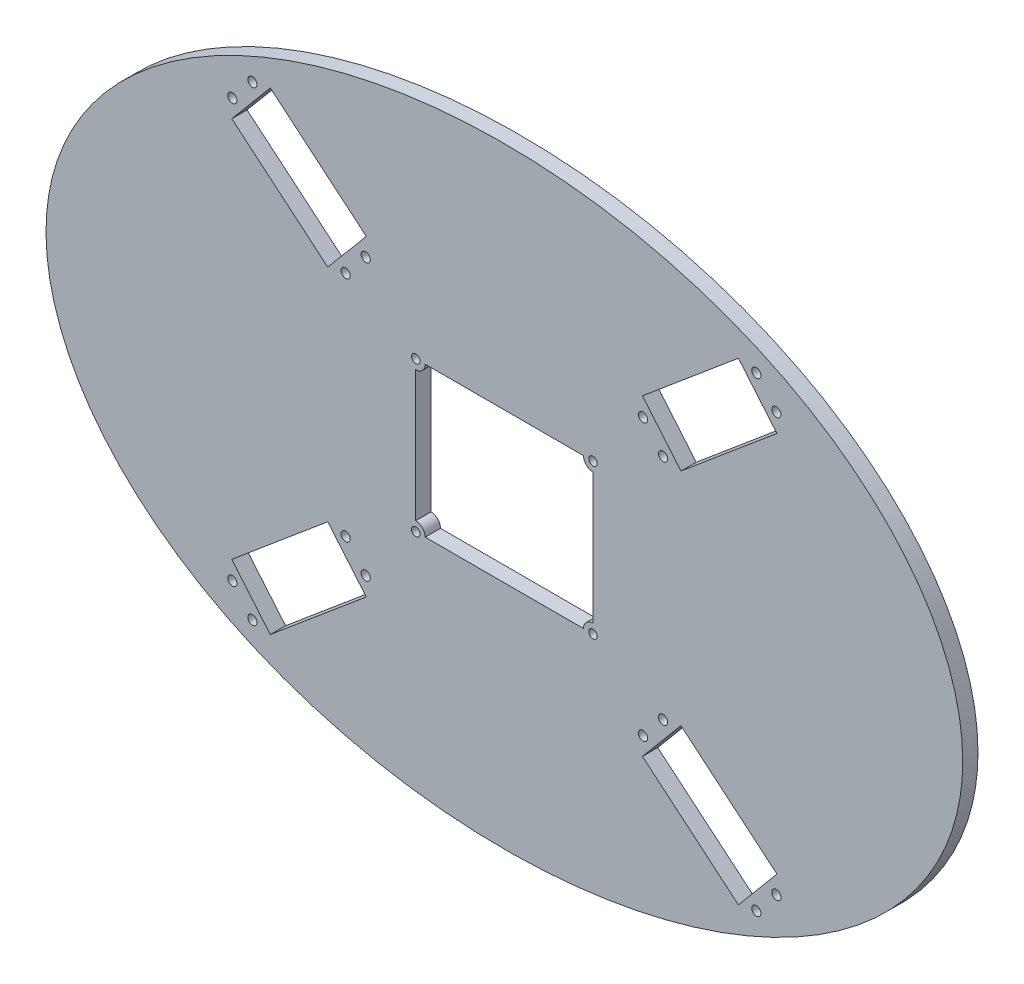
from build123d import *

# Parameters (mm, degrees)
SKETCH1_RX               = 150
SKETCH1_RY               = 100
BOSS_EXTRUDE1_DEPTH      = 5
CUT_EXTRUDE1_DEPTH       = 181.346887969
CUT_EXTRUDE2_DEPTH       = 181.346887969
CUT_EXTRUDE3_DEPTH       = 181.346887969
CUT_EXTRUDE4_DEPTH       = 181.346887969
CUT_EXTRUDE5_DEPTH       = 181.346887969
SKETCH11_W               = 1.375
SKETCH11_H               = 12.5
SKETCH12_W               = 1.375
SKETCH12_H               = 12.5
SKETCH13_W               = 1.375
SKETCH13_H               = 12.5
SKETCH14_W               = 1.375
SKETCH14_H               = 12.5
F_3_0_3_DIAMETER_HOLE1_D = 3


with BuildPart() as part:
    # Sketch1 → Boss-Extrude1 (new body)
    with BuildSketch(Plane.XY.offset(5)):
        with Locations(Location((0, 0), (0, 0, 0))):
            Ellipse(SKETCH1_RX, SKETCH1_RY)
    extrude(amount=-BOSS_EXTRUDE1_DEPTH)

    # Sketch2 → Cut-Extrude1 (cut, through all)
    with BuildSketch(Plane(origin=(0, 0, 0), x_dir=(-1, 0, 0), z_dir=(0, 0, -1))):
        with BuildLine():
            Line((25.9, 24.5), (-25.9, 24.5))
            ThreePointArc((-25.9, 24.5), (-26.807968978, 22.307968978), (-29, 21.4))
            Line((-29, 21.4), (-29, -21.4))
            ThreePointArc((-29, -21.4), (-26.807968978, -22.307968978), (-25.9, -24.5))
            Line((-25.9, -24.5), (25.9, -24.5))
            ThreePointArc((25.9, -24.5), (26.807968978, -22.307968978), (29, -21.4))
            Line((29, -21.4), (29, 21.4))
            ThreePointArc((29, 21.4), (26.807968978, 22.307968978), (25.9, 24.5))
        make_face()
    extrude(amount=-CUT_EXTRUDE1_DEPTH, mode=Mode.SUBTRACT)

    # Sketch7 → Cut-Extrude2 (cut, through all)
    with BuildSketch(Plane.XY.offset(5)):
        Polygon((45.191487885, -51.097974081), (76.599310052, -77.452266078), (89.197947202, -62.437794993), (57.790125034, -36.083502996), align=None)
    extrude(amount=-CUT_EXTRUDE2_DEPTH, mode=Mode.SUBTRACT)

    # Sketch8 → Cut-Extrude3 (cut, through all)
    with BuildSketch(Plane.XY.offset(5)):
        Polygon((-76.598710341, -77.451785496), (-45.190888173, -51.097493499), (-57.789525323, -36.083022414), (-89.197347491, -62.437314411), align=None)
    extrude(amount=-CUT_EXTRUDE3_DEPTH, mode=Mode.SUBTRACT)

    # Sketch9 → Cut-Extrude4 (cut, through all)
    with BuildSketch(Plane.XY.offset(5)):
        Polygon((-45.191671729, 51.098342778), (-76.599493897, 77.452634775), (-89.198131047, 62.43816369), (-57.790308879, 36.083871693), align=None)
    extrude(amount=-CUT_EXTRUDE4_DEPTH, mode=Mode.SUBTRACT)

    # Sketch10 → Cut-Extrude5 (cut, through all)
    with BuildSketch(Plane(origin=(0, 0, 0), x_dir=(-1, 0, 0), z_dir=(0, 0, -1))):
        Polygon((-89.198042922, 62.437370539), (-57.790220755, 36.083078542), (-45.191583605, 51.097549627), (-76.599405773, 77.451841624), align=None)
    extrude(amount=-CUT_EXTRUDE5_DEPTH, mode=Mode.SUBTRACT)

    # Sketch11 → Cut-Revolve1 (revolve, cut)
    with BuildSketch(Plane(origin=(0, -24.5, 0), x_dir=(1, 0, 0), z_dir=(0, 1, 0))):
        with Locations((29.6875, -6.25)):
            Rectangle(SKETCH11_W, SKETCH11_H)
    revolve(axis=Axis((29, -24.5, 0), (0, 0, 1)), mode=Mode.SUBTRACT)

    # Sketch12 → Cut-Revolve2 (revolve, cut)
    with BuildSketch(Plane(origin=(0, 24.5, 0), x_dir=(1, 0, 0), z_dir=(0, 1, 0))):
        with Locations((29.6875, -6.25)):
            Rectangle(SKETCH12_W, SKETCH12_H)
    revolve(axis=Axis((29, 24.5, 0), (0, 0, 1)), mode=Mode.SUBTRACT)

    # Sketch13 → Cut-Revolve3 (revolve, cut)
    with BuildSketch(Plane(origin=(0, 24.5, 0), x_dir=(1, 0, 0), z_dir=(0, 1, 0))):
        with Locations((-28.3125, -6.25)):
            Rectangle(SKETCH13_W, SKETCH13_H)
    revolve(axis=Axis((-29, 24.5, 0), (0, 0, 1)), mode=Mode.SUBTRACT)

    # Sketch14 → Cut-Revolve4 (revolve, cut)
    with BuildSketch(Plane(origin=(0, -24.5, 0), x_dir=(1, 0, 0), z_dir=(0, 1, 0))):
        with Locations((-28.3125, -6.25)):
            Rectangle(SKETCH14_W, SKETCH14_H)
    revolve(axis=Axis((-29, -24.5, 0), (0, 0, 1)), mode=Mode.SUBTRACT)

    # Ø3.0 (3) Diameter Hole1 (through all)
    with Locations(Plane.XY.offset(5)):
        with Locations((82.454776258, -76.230171352), (89.011209876, -68.416518032), (45.378225211, -45.119251043), (-45.378409055, 45.119619739), (-45.377625499, -45.118770461), (-51.934059118, -37.305117141), (-82.454176546, -76.22969077), (-89.010610165, -68.41603745), (51.934658829, -37.305597723), (51.93475455, 37.305173269), (45.378320931, 45.118826588), (82.454871978, 76.229746897), (-51.934842674, 37.305966419), (-82.454960102, 76.230540048), (-89.011393721, 68.416886728), (89.011305596, 68.416093578)):
            Hole(F_3_0_3_DIAMETER_HOLE1_D / 2)


solid = part.part
